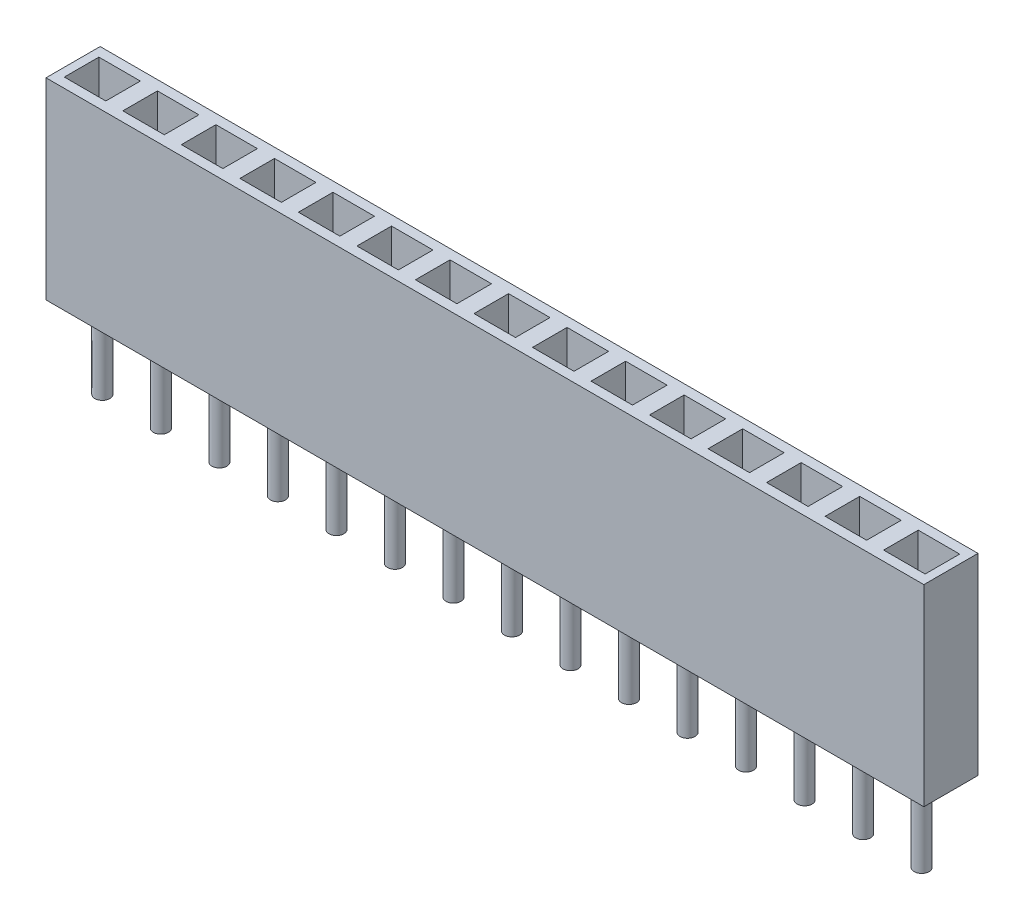
from build123d import *

# Parameters (mm, degrees)
ESQUISSE1_W                = 2.54
ESQUISSE1_H                = 2.35
BOSS_EXTRU_1_DEPTH         = 8.35
ESQUISSE3_W                = 1.8
ESQUISSE3_H                = 1.5
ENL_V_MAT_EXTRU_1_DEPTH    = 5.5
ESQUISSE2_R                = 0.325
BOSS_EXTRU_2_DEPTH         = 3.5
ESQUISSE4_R                = 0.325
ENL_V_MAT_EXTRU_3_DEPTH    = 2
R_P_TITION_LIN_AIRE1_COUNT = 15
R_P_TITION_LIN_AIRE1_PITCH = 2.54


with BuildPart() as part:
    # Esquisse1 → Boss.-Extru.1 (new body)
    with BuildSketch(Plane(origin=(0, 0, 0), x_dir=(1, 0, 0), z_dir=(0, 1, 0))):
        with Locations((1.27, 1.175)):
            Rectangle(ESQUISSE1_W, ESQUISSE1_H)
    boss_extru_1 = extrude(amount=BOSS_EXTRU_1_DEPTH)

    # Esquisse3 → Enlèv. mat.-Extru.1 (cut)
    with BuildSketch(Plane(origin=(0, 8.35, 0), x_dir=(1, 0, 0), z_dir=(0, 1, 0))):
        with Locations((1.27, 1.175)):
            Rectangle(ESQUISSE3_W, ESQUISSE3_H)
    enl_v_mat_extru_1 = extrude(amount=-ENL_V_MAT_EXTRU_1_DEPTH, mode=Mode.SUBTRACT)

    # Esquisse2 → Boss.-Extru.2 (add)
    with BuildSketch(Plane.XZ):
        with Locations(Location((1.27, -1.175, 0), (0, 0, 270))):
            Circle(ESQUISSE2_R)
    boss_extru_2 = extrude(amount=BOSS_EXTRU_2_DEPTH)

    # Esquisse4 → Enlèv. mat.-Extru.3 (cut)
    with BuildSketch(Plane(origin=(0, 2.85, 0), x_dir=(1, 0, 0), z_dir=(0, 1, 0))):
        with Locations(Location((1.27, 1.175, 0), (0, 0, 90))):
            Circle(ESQUISSE4_R)
    enl_v_mat_extru_3 = extrude(amount=-ENL_V_MAT_EXTRU_3_DEPTH, mode=Mode.SUBTRACT)

    # Répétition linéaire1: Boss.-Extru.1, Enlèv. mat.-Extru.1, Boss.-Extru.2, Enlèv. mat.-Extru.3 ×15
    with Locations(*[(i * R_P_TITION_LIN_AIRE1_PITCH, 0, 0) for i in range(1, R_P_TITION_LIN_AIRE1_COUNT)]):
        add(boss_extru_1)
        add(enl_v_mat_extru_1, mode=Mode.SUBTRACT)
        add(boss_extru_2)
        add(enl_v_mat_extru_3, mode=Mode.SUBTRACT)


solid = part.part
